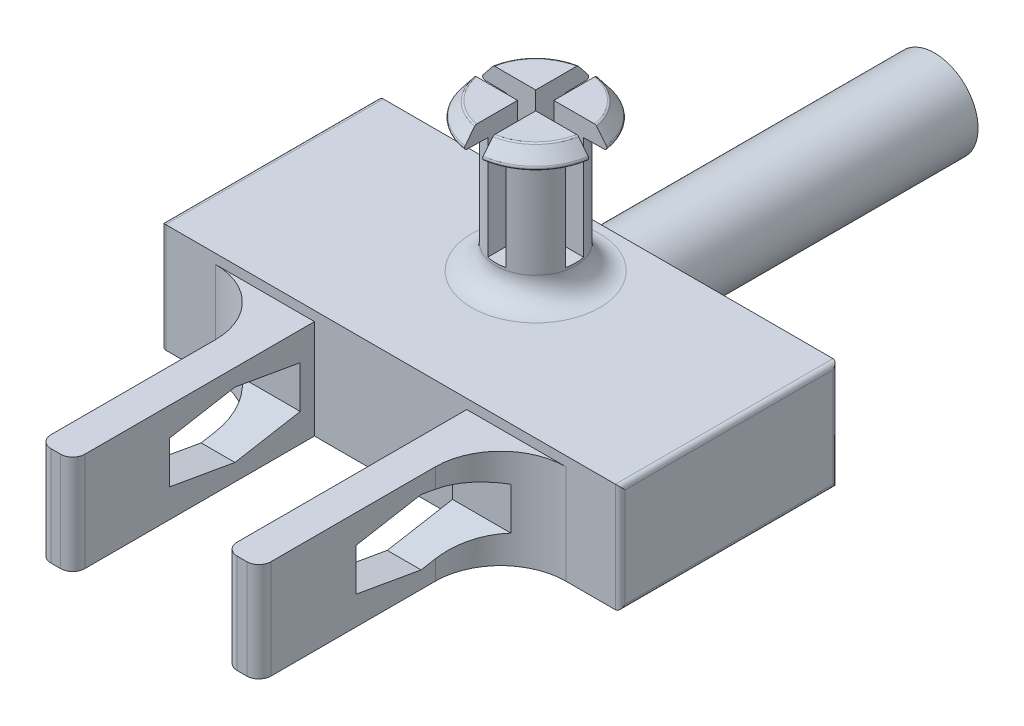
from build123d import *

# Parameters (mm, degrees)
DODANIE_WYCI_GNI_CIE1_DEPTH     = 4.5
DODANIE_WYCI_GNI_CIE2_DEPTH     = 4.1
SZKIC2_R                        = 1.8
DODANIE_WYCI_GNI_CIE3_DEPTH     = 13.5
WYTNIJ_WYCI_GNI_CIE2_DEPTH      = 23.456012558
WYTNIJ_WYCI_GNI_CIE2_DEPTH_BACK = 23.456012558
ZAOKR_GLENIE1_R                 = 0.5
ZAOKR_GLENIE2_R                 = 0.2
SZKIC4_R                        = 1.65
DODANIE_WYCI_GNI_CIE4_DEPTH     = 5.1
SZKIC5_R                        = 1.65
DODANIE_WYCI_GNI_CIE5_DEPTH     = 1
ZAOKR_GLENIE4_R                 = 1
ZAOKR_GLENIE5_R                 = 0.1
WYTNIJ_WYCI_GNI_CIE3_DEPTH      = 5


with BuildPart() as part:
    # Szkic1 → Dodanie-wyciągnięcie1 (new body)
    with BuildSketch(Plane(origin=(0, 0, 0), x_dir=(1, 0, 0), z_dir=(0, 1, 0))):
        Polygon((3.15, -4.5), (4.55, -4.5), (7.25, -4.5), (9.5, -4.5), (9.5, 4.5), (2.579268293, 4.5), (-2.579268293, 4.5), (-9.5, 4.5), (-9.5, -4.5), (-7.25, -4.5), (-4.55, -4.5), (-3.15, -4.5), align=None)
    extrude(amount=DODANIE_WYCI_GNI_CIE1_DEPTH)

    # Szkic1<7> → Dodanie-wyciągnięcie2 (add)
    with BuildSketch(Plane(origin=(0, 0, 0), x_dir=(1, 0, 0), z_dir=(0, 1, 0))):
        with BuildLine():
            Line((4.55, -14.5), (4.55, -7.2))
            ThreePointArc((4.55, -7.2), (5.340811691, -5.290811691), (7.25, -4.5))
            Line((7.25, -4.5), (3.15, -4.5))
            Line((3.15, -4.5), (3.15, -14.5))
            Line((3.15, -14.5), (4.55, -14.5))
        make_face()
        with BuildLine():
            Line((-3.15, -14.5), (-3.15, -4.5))
            Line((-3.15, -4.5), (-7.25, -4.5))
            ThreePointArc((-7.25, -4.5), (-5.340811691, -5.290811691), (-4.55, -7.2))
            Line((-4.55, -7.2), (-4.55, -14.5))
            Line((-4.55, -14.5), (-3.15, -14.5))
        make_face()
    extrude(amount=DODANIE_WYCI_GNI_CIE2_DEPTH)

    # Szkic2 → Dodanie-wyciągnięcie3 (add)
    with BuildSketch(Plane(origin=(0, 0, -4.5), x_dir=(-1, 0, 0), z_dir=(0, 0, -1))):
        with Locations((0, 2.25)):
            Circle(SZKIC2_R)
    extrude(amount=DODANIE_WYCI_GNI_CIE3_DEPTH)

    # Szkic3 → Wytnij-wyciągnięcie2 (cut, two sides: drawn at the far end of the back side and taken through both)
    with BuildSketch(Plane(origin=(-3.15, 0, 0), x_dir=(0, 0, -1), z_dir=(1, 0, 0)).offset(-WYTNIJ_WYCI_GNI_CIE2_DEPTH_BACK)):
        Polygon((-7.790001582, 3.4), (-10.490001582, 2.923917152), (-10.490001582, 1.176082848), (-7.790001582, 0.7), (-5.090001582, 1.176082848), (-5.090001582, 2.923917152), align=None)
    extrude(amount=WYTNIJ_WYCI_GNI_CIE2_DEPTH + WYTNIJ_WYCI_GNI_CIE2_DEPTH_BACK, mode=Mode.SUBTRACT)

    # Zaokrąglenie1
    zaokr_glenie1_edges = [part.edges().sort_by_distance(p)[0] for p in [
        (3.15, 2.05, 14.5),
        (4.55, 2.05, 14.5),
        (-4.55, 2.05, 14.5),
        (-3.15, 2.05, 14.5),
    ]]
    fillet(zaokr_glenie1_edges, radius=ZAOKR_GLENIE1_R)

    # Zaokrąglenie2
    zaokr_glenie2_edges = [part.edges().sort_by_distance(p)[0] for p in [
        (-9.5, 2.25, -4.5),
        (-9.5, 4.5, 0),
        (9.5, 0, 0),
        (-9.5, 2.25, 4.5),
        (9.5, 2.25, 4.5),
        (9.5, 2.25, -4.5),
        (9.5, 4.5, 0),
        (-9.5, 0, 0),
    ]]
    fillet(zaokr_glenie2_edges, radius=ZAOKR_GLENIE2_R)

    # Szkic4 → Dodanie-wyciągnięcie4 (add)
    with BuildSketch(Plane(origin=(0, 4.5, 0), x_dir=(1, 0, 0), z_dir=(0, 1, 0))):
        with Locations((0, 1.5)):
            Circle(SZKIC4_R)
    extrude(amount=DODANIE_WYCI_GNI_CIE4_DEPTH)

    # Szkic5 → Dodanie-wyciągnięcie5 (add)
    with BuildSketch(Plane(origin=(0, 9.6, 0), x_dir=(1, 0, 0), z_dir=(0, 1, 0))):
        with Locations((0, 1.5)):
            Circle(SZKIC5_R)
    extrude(amount=DODANIE_WYCI_GNI_CIE5_DEPTH)

    # Zaokrąglenie4
    zaokr_glenie4_edges = [part.edges().sort_by_distance(p)[0] for p in [
        (-1.65, 4.5, -1.5),
    ]]
    fillet(zaokr_glenie4_edges, radius=ZAOKR_GLENIE4_R)

    # Szkic7 → Obrót1 (revolve)
    with BuildSketch(Plane(origin=(0, 0, 0), x_dir=(0, 0, -1), z_dir=(1, 0, 0))):
        Polygon((3.15, 10.6), (3.65, 10.6), (4.197835565, 9.9), (3.15, 9.881709962), align=None)
    revolve(axis=Axis((0, 16.6, -1.5), (0, -1, 0)))

    # Zaokrąglenie5
    zaokr_glenie5_edges = [part.edges().sort_by_distance(p)[0] for p in [
        (0, 10.6, 0.65),
        (0, 9.9, 1.197835565),
    ]]
    fillet(zaokr_glenie5_edges, radius=ZAOKR_GLENIE5_R)

    # Szkic6 → Wytnij-wyciągnięcie3 (cut)
    with BuildSketch(Plane(origin=(0, 10.6, 0), x_dir=(1, 0, 0), z_dir=(0, 1, 0))):
        with BuildLine():
            Line((0.375, 4.664465969), (0.375, 1.875))
            Line((0.375, 1.875), (3.164465969, 1.875))
            ThreePointArc((3.164465969, 1.875), (3.186607894, 1.5), (3.164465969, 1.125))
            Line((3.164465969, 1.125), (0.375, 1.125))
            Line((0.375, 1.125), (0.375, -1.664465969))
            ThreePointArc((0.375, -1.664465969), (0, -1.686607894), (-0.375, -1.664465969))
            Line((-0.375, -1.664465969), (-0.375, 1.125))
            Line((-0.375, 1.125), (-3.164465969, 1.125))
            ThreePointArc((-3.164465969, 1.125), (-3.186607894, 1.5), (-3.164465969, 1.875))
            Line((-3.164465969, 1.875), (-0.375, 1.875))
            Line((-0.375, 1.875), (-0.375, 4.664465969))
            ThreePointArc((-0.375, 4.664465969), (0, 4.686607894), (0.375, 4.664465969))
        make_face()
    extrude(amount=-WYTNIJ_WYCI_GNI_CIE3_DEPTH, mode=Mode.SUBTRACT)


solid = part.part
